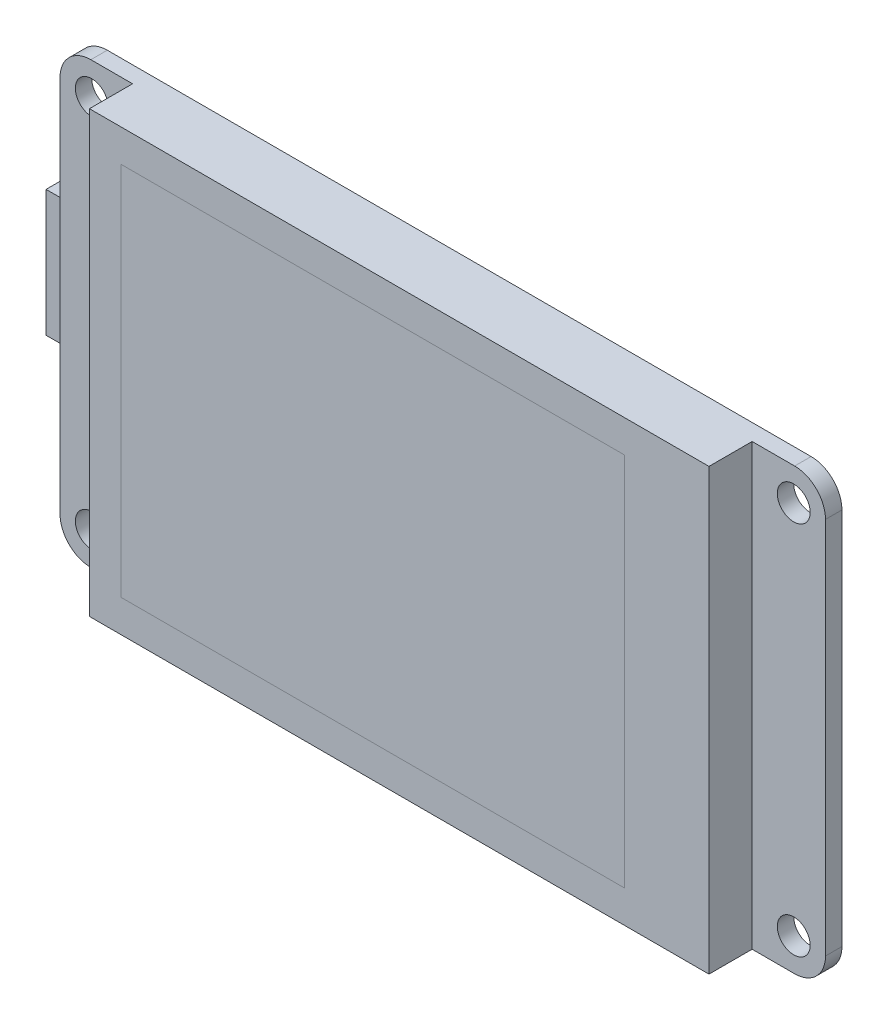
from build123d import *

# Parameters (mm, degrees)
SKETCH1_W                  = 74.5
SKETCH1_H                  = 42.8
BOSS_EXTRUDE1_DEPTH        = 1.6002
SKETCH2_W                  = 60.3
SKETCH2_H                  = 42.8
BOSS_EXTRUDE2_DEPTH        = 4.2
F_3_2_3_2_DIAMETER_HOLE1_D = 3.2
FILLET1_R                  = 3
SKETCH6_W                  = 8
SKETCH6_H                  = 15
BOSS_EXTRUDE3_DEPTH        = 6.25
SKETCH7_W                  = 5.7
SKETCH7_H                  = 12.3
BOSS_EXTRUDE4_DEPTH        = 3.5
SKETCH8_W                  = 14.9
SKETCH8_H                  = 14.75
BOSS_EXTRUDE5_DEPTH        = 2.15
SKETCH9_W                  = 11.03
SKETCH9_H                  = 1.1
BOSS_EXTRUDE6_DEPTH        = 2.5


with BuildPart() as part:
    # Sketch1 → Boss-Extrude1 (new body)
    with BuildSketch(Plane.XY):
        Rectangle(SKETCH1_W, SKETCH1_H)
    extrude(amount=-BOSS_EXTRUDE1_DEPTH)

    # Sketch2 → Boss-Extrude2 (add)
    with BuildSketch(Plane.XY):
        with Locations((-0.04, 0)):
            Rectangle(SKETCH2_W, SKETCH2_H)
    extrude(amount=BOSS_EXTRUDE2_DEPTH)

    # Ø3.2 (3.2) Diameter Hole1 (through all)
    with Locations(Plane.XY):
        with Locations((-34.16, 18.245), (34.16, -18.245), (34.16, 18.245), (-34.16, -18.245)):
            Hole(F_3_2_3_2_DIAMETER_HOLE1_D / 2)

    # Fillet1
    fillet1_edges = [part.edges().sort_by_distance(p)[0] for p in [
        (37.25, 21.4, -0.8001),
        (37.25, -21.4, -0.8001),
        (-37.25, -21.4, -0.8001),
        (-37.25, 21.4, -0.8001),
    ]]
    fillet(fillet1_edges, radius=FILLET1_R)

    # Sketch6 → Boss-Extrude3 (add)
    with BuildSketch(Plane(origin=(0, 0, -1.6002), x_dir=(-1, 0, 0), z_dir=(0, 0, -1))):
        with Locations((33.25, 0)):
            Rectangle(SKETCH6_W, SKETCH6_H)
    extrude(amount=BOSS_EXTRUDE3_DEPTH)

    # Sketch7 → Boss-Extrude4 (add)
    with BuildSketch(Plane.ZY.offset(37.25)):
        with Locations((-4.9902, 0)):
            Rectangle(SKETCH7_W, SKETCH7_H)
    extrude(amount=BOSS_EXTRUDE4_DEPTH)

    # Sketch8 → Boss-Extrude5 (add)
    with BuildSketch(Plane(origin=(0, 0, -1.6002), x_dir=(-1, 0, 0), z_dir=(0, 0, -1))):
        with Locations((16, -14.025)):
            Rectangle(SKETCH8_W, SKETCH8_H)
    extrude(amount=BOSS_EXTRUDE5_DEPTH)

    # Sketch9 → Boss-Extrude6 (add)
    with BuildSketch(Plane.XZ.offset(21.4)):
        with Locations((-14.835, -3.1902)):
            Rectangle(SKETCH9_W, SKETCH9_H)
    extrude(amount=BOSS_EXTRUDE6_DEPTH)


solid = part.part
